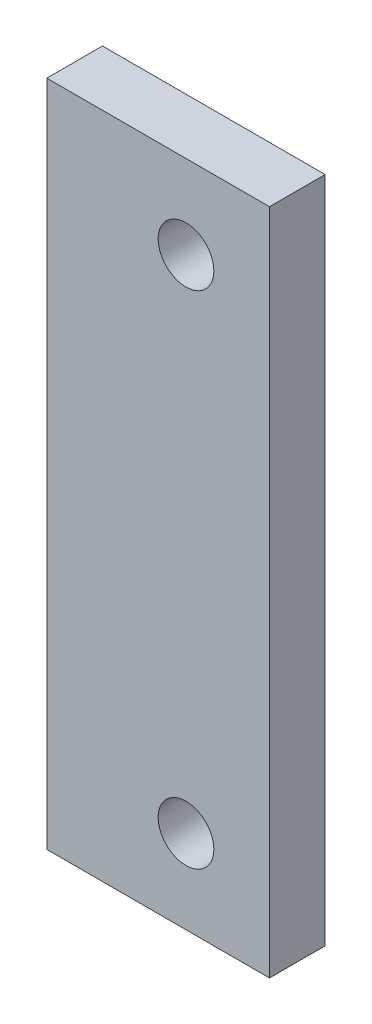
from build123d import *

# Parameters (mm, degrees)
SKETCH1_W           = 40
SKETCH1_H           = 120
BOSS_EXTRUDE1_DEPTH = 10
SKETCH2_R           = 5
CUT_EXTRUDE2_DEPTH  = 362.386219992


with BuildPart() as part:
    # Sketch1 → Boss-Extrude1 (new body)
    with BuildSketch(Plane.XY):
        with Locations((10, -300)):
            Rectangle(SKETCH1_W, SKETCH1_H)
    extrude(amount=BOSS_EXTRUDE1_DEPTH)

    # Sketch2 → Cut-Extrude2 (cut, through all)
    with BuildSketch(Plane.XY):
        with Locations((15, -255)):
            Circle(SKETCH2_R)
        with Locations((15, -345)):
            Circle(SKETCH2_R)
    extrude(amount=CUT_EXTRUDE2_DEPTH, mode=Mode.SUBTRACT)


solid = part.part
